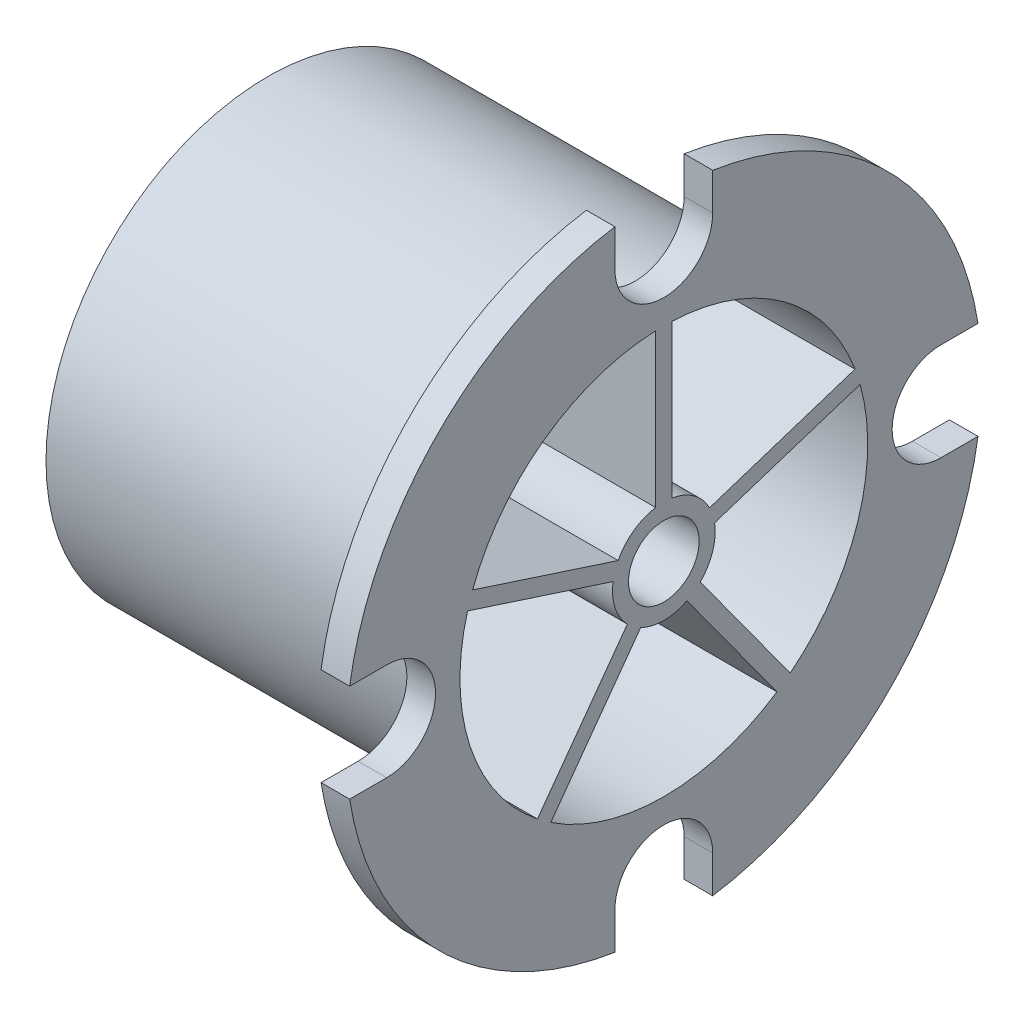
from build123d import *

# Parameters (mm, degrees)
SKETCH1_R                = 34.29
BOSS_EXTRUDE1_DEPTH      = 61.214
SKETCH2_R                = 49.149
BOSS_EXTRUDE2_DEPTH      = 4.4196
SKETCH3_R                = 31.51505
CUT_EXTRUDE1_DEPTH       = 24.4094
SKETCH4_R                = 5.461
CUT_EXTRUDE2_DEPTH       = 93.619664208
SKETCH5_R                = 31.6865
CUT_EXTRUDE3_DEPTH       = 34.671
CUT_EXTRUDE4_DEPTH       = 93.619664208
CIRPATTERN1_COUNT        = 4
SKETCH7_R                = 7.9375
SKETCH7_R_2              = 5.461
BOSS_EXTRUDE3_DEPTH      = 24.4094
SKETCH8_W                = 2.54
SKETCH8_H                = 28.130195785
BOSS_EXTRUDE4_DEPTH      = 24.4094
CIRPATTERN2_COUNT        = 5
BOSS_EXTRUDE5_START      = 22.86
SKETCH9_R                = 7.9629
SKETCH9_R_2              = 5.461
BOSS_EXTRUDE5_DEPTH      = 22.86
BOSS_EXTRUDE6_DEPTH      = 22.3012
FILLET1_R                = 0.508
SKETCH11_R               = 1.651
BOSS_EXTRUDE7_DEPTH      = 34.925
CIRPATTERN3_COUNT        = 10
FILLET1_OF_CIRPATTERN3_R = 0.508


with BuildPart() as part:
    # Sketch1 → Boss-Extrude1 (new body)
    with BuildSketch(Plane(origin=(0, 0, 0), x_dir=(0, 0, -1), z_dir=(1, 0, 0))):
        with Locations(Location((0, 0, 0), (0, 0, 180))):
            Circle(SKETCH1_R)
    extrude(amount=BOSS_EXTRUDE1_DEPTH)

    # Sketch2 → Boss-Extrude2 (add)
    with BuildSketch(Plane(origin=(61.214, 0, 0), x_dir=(0, 0, -1), z_dir=(1, 0, 0))):
        Circle(SKETCH2_R)
    extrude(amount=-BOSS_EXTRUDE2_DEPTH)

    # Sketch3 → Cut-Extrude1 (cut)
    with BuildSketch(Plane(origin=(61.214, 0, 0), x_dir=(0, 0, -1), z_dir=(1, 0, 0))):
        Circle(SKETCH3_R)
    extrude(amount=-CUT_EXTRUDE1_DEPTH, mode=Mode.SUBTRACT)

    # Sketch4 → Cut-Extrude2 (cut, through all)
    with BuildSketch(Plane.ZY):
        Circle(SKETCH4_R)
    extrude(amount=-CUT_EXTRUDE2_DEPTH, mode=Mode.SUBTRACT)

    # Sketch5 → Cut-Extrude3 (cut)
    with BuildSketch(Plane.ZY):
        Circle(SKETCH5_R)
    extrude(amount=-CUT_EXTRUDE3_DEPTH, mode=Mode.SUBTRACT)

    # Sketch6 → Cut-Extrude4 (cut, through all)
    with BuildSketch(Plane(origin=(61.214, 0, 0), x_dir=(0, 0, -1), z_dir=(1, 0, 0))):
        with BuildLine():
            Line((-7.5565, 42.849632283), (-7.5565, 48.564632283))
            Line((-7.5565, 48.564632283), (-7.5565, 51.948068803))
            Line((-7.5565, 51.948068803), (7.5565, 51.948068803))
            Line((7.5565, 51.948068803), (7.5565, 48.564632283))
            Line((7.5565, 48.564632283), (7.5565, 42.849632283))
            ThreePointArc((7.5565, 42.849632283), (0, 35.293132283), (-7.5565, 42.849632283))
        make_face()
    cut_extrude4 = extrude(amount=-CUT_EXTRUDE4_DEPTH, mode=Mode.SUBTRACT)

    # CirPattern1: Cut-Extrude4 ×4 about axis
    cirpattern1_axis = Axis((0, 0, 0), (1, 0, 0))
    for i in range(1, CIRPATTERN1_COUNT):
        add(cut_extrude4.rotate(cirpattern1_axis, i * 360 / CIRPATTERN1_COUNT), mode=Mode.SUBTRACT)

    # Sketch7 → Boss-Extrude3 (add)
    with BuildSketch(Plane(origin=(36.8046, 0, 0), x_dir=(0, 0, -1), z_dir=(1, 0, 0))):
        Circle(SKETCH7_R)
        with Locations(Location((0, 0, 0), (0, 0, 180))):
            Circle(SKETCH7_R_2, mode=Mode.SUBTRACT)
    extrude(amount=BOSS_EXTRUDE3_DEPTH)

    # Sketch8 → Boss-Extrude4 (add)
    with BuildSketch(Plane(origin=(36.8046, 0, 0), x_dir=(0, 0, -1), z_dir=(1, 0, 0))):
        with Locations((0, 20.070733139)):
            Rectangle(SKETCH8_W, SKETCH8_H)
    boss_extrude4 = extrude(amount=BOSS_EXTRUDE4_DEPTH)

    # CirPattern2: Boss-Extrude4 ×5 about axis
    cirpattern2_axis = Axis((0, 0, 0), (1, 0, 0))
    for i in range(1, CIRPATTERN2_COUNT):
        add(boss_extrude4.rotate(cirpattern2_axis, i * 360 / CIRPATTERN2_COUNT))

    # Sketch9 → Boss-Extrude5 (add)
    with BuildSketch(Plane.ZY.offset(-34.671).offset(BOSS_EXTRUDE5_START)):
        Circle(SKETCH9_R)
        Circle(SKETCH9_R_2, mode=Mode.SUBTRACT)
    extrude(amount=-BOSS_EXTRUDE5_DEPTH)

    # Sketch10 → Boss-Extrude6 (add)
    with BuildSketch(Plane.ZY.offset(-34.671)):
        Polygon((-2.978632136, 6.209503272), (-0.525180538, 6.866903647), (-7.295536474, 32.134215987), (-9.748988073, 31.476815612), align=None)
    boss_extrude6 = extrude(amount=BOSS_EXTRUDE6_DEPTH)

    # Fillet1
    fillet1_edges = [part.edges().sort_by_distance(p)[0] for p in [
        (12.3698, 18.758965181, -6.34125032),
        (12.3698, 19.416365555, -3.887798721),
    ]]
    fillet(fillet1_edges, radius=FILLET1_R)

    # Sketch11 → Boss-Extrude7 (add)
    with BuildSketch(Plane.ZY.offset(-34.671)):
        with Locations(Location((-8.02028457, 29.932109505, 0), (0, 0, 180))):
            Circle(SKETCH11_R)
    boss_extrude7 = extrude(amount=BOSS_EXTRUDE7_DEPTH)

    # CirPattern3: Boss-Extrude6, Boss-Extrude7 ×10 about axis
    cirpattern3_axis = Axis((0, 0, 0), (1, 0, 0))
    add([boss_extrude6.rotate(cirpattern3_axis, i * 360 / CIRPATTERN3_COUNT) for i in range(1, CIRPATTERN3_COUNT)])
    add([boss_extrude7.rotate(cirpattern3_axis, i * 360 / CIRPATTERN3_COUNT) for i in range(1, CIRPATTERN3_COUNT)])

    # Fillet1 of CirPattern3
    fillet1_of_cirpattern3_edges = [part.edges().sort_by_distance(p)[0] for p in [
        (12.3698, 18.903615047, 5.896063807),
        (12.3698, 17.993360456, 8.26735809),
        (12.3698, 11.827726476, 15.88128196),
        (12.3698, 9.697503234, 17.264665109),
        (12.3698, 0.234048401, 19.800390189),
        (12.3698, -2.302470618, 19.66745686),
        (12.3698, -11.449028209, 16.156422356),
        (12.3698, -13.422978951, 14.557948563),
        (12.3698, -18.758965181, 6.34125032),
        (12.3698, -19.416365555, 3.887798721),
        (12.3698, -18.903615047, -5.896063807),
        (12.3698, -17.993360456, -8.26735809),
        (12.3698, -11.827726476, -15.88128196),
        (12.3698, -9.697503234, -17.264665109),
        (12.3698, -0.234048401, -19.800390189),
        (12.3698, 2.302470618, -19.66745686),
        (12.3698, 11.449028209, -16.156422356),
        (12.3698, 13.422978951, -14.557948563),
    ]]
    fillet(fillet1_of_cirpattern3_edges, radius=FILLET1_OF_CIRPATTERN3_R)


solid = part.part
